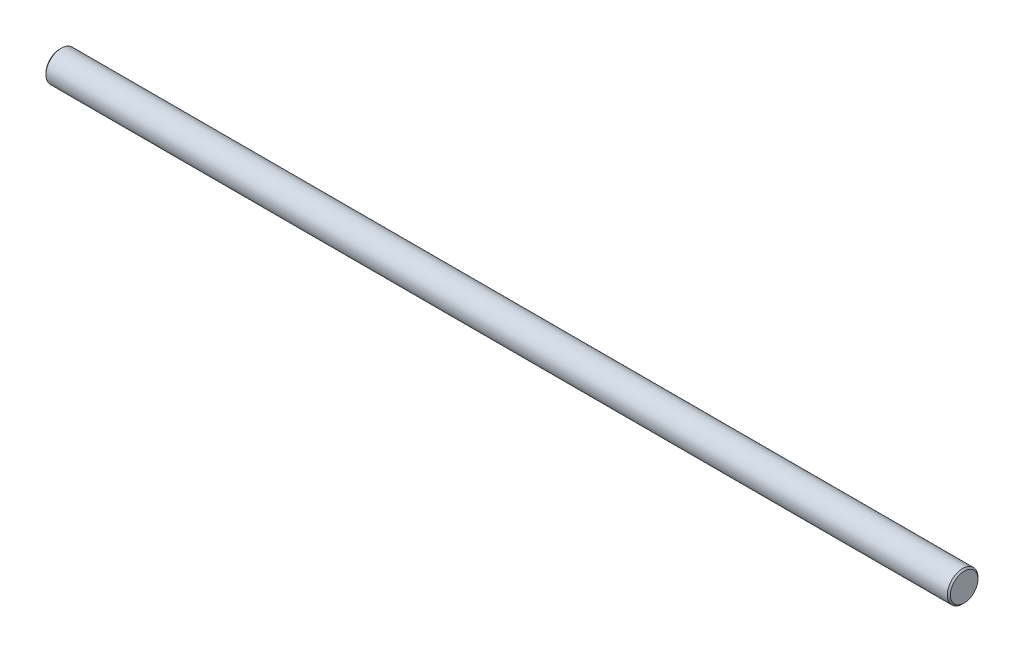
from build123d import *

# Parameters (mm, degrees)
SKETCH2_R                = 3
BOSS_EXTRUDE1_DEPTH      = 88.4
CHAMFER1_SIZE            = 0.3
CHAMFER1_OF_MIRROR1_SIZE = 0.3


with BuildPart() as part:
    # Sketch2 → Boss-Extrude1 (new body)
    with BuildSketch(Plane(origin=(0, 0, 0), x_dir=(0, 0, -1), z_dir=(1, 0, 0))):
        with Locations((0, 10.573433301)):
            Circle(SKETCH2_R)
    boss_extrude1 = extrude(amount=-BOSS_EXTRUDE1_DEPTH)

    # Chamfer1
    chamfer1_edges = [part.edges().sort_by_distance(p)[0] for p in [
        (0, 10.573433301, 3),
    ]]
    chamfer(chamfer1_edges, length=CHAMFER1_SIZE)

    # Mirror1: Boss-Extrude1 across plane
    add(boss_extrude1.mirror(Plane(origin=(-88.4, 10.573433301, 0), x_dir=(0, 0, 1), z_dir=(1, 0, 0))))

    # Chamfer1 of Mirror1
    chamfer1_of_mirror1_edges = [part.edges().sort_by_distance(p)[0] for p in [
        (-176.8, 10.573433301, 3),
    ]]
    chamfer(chamfer1_of_mirror1_edges, length=CHAMFER1_OF_MIRROR1_SIZE)


solid = part.part
